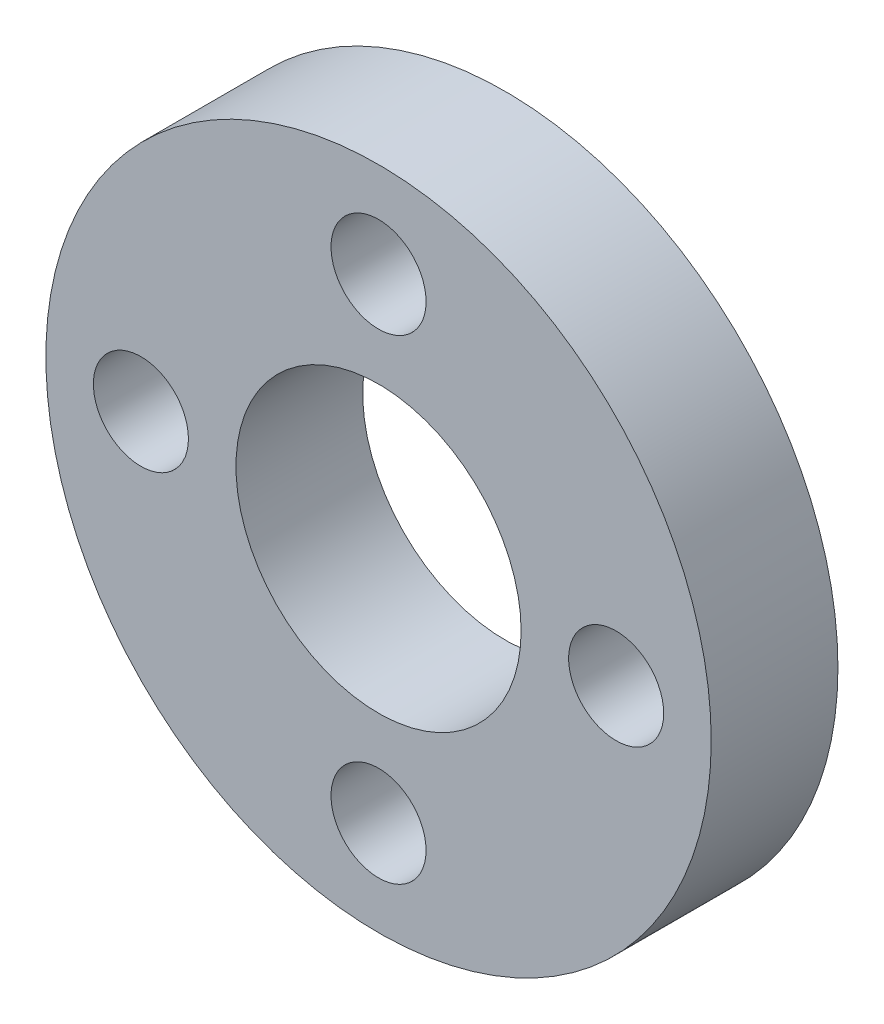
from build123d import *

# Parameters (mm, degrees)
MODEL_R             = 10.5
MODEL_R_2           = 1.5
MODEL_R_3           = 4.5
BOSS_EXTRUDE1_DEPTH = 4


with BuildPart() as part:
    # Model → Boss-Extrude1 (new body)
    with BuildSketch(Plane.XY):
        Circle(MODEL_R)
        with Locations((-7.5, 0)):
            Circle(MODEL_R_2, mode=Mode.SUBTRACT)
        with Locations((0, 7.5)):
            Circle(MODEL_R_2, mode=Mode.SUBTRACT)
        with Locations((7.5, 0)):
            Circle(MODEL_R_2, mode=Mode.SUBTRACT)
        with Locations((0, -7.5)):
            Circle(MODEL_R_2, mode=Mode.SUBTRACT)
        Circle(MODEL_R_3, mode=Mode.SUBTRACT)
    extrude(amount=BOSS_EXTRUDE1_DEPTH)


solid = part.part
